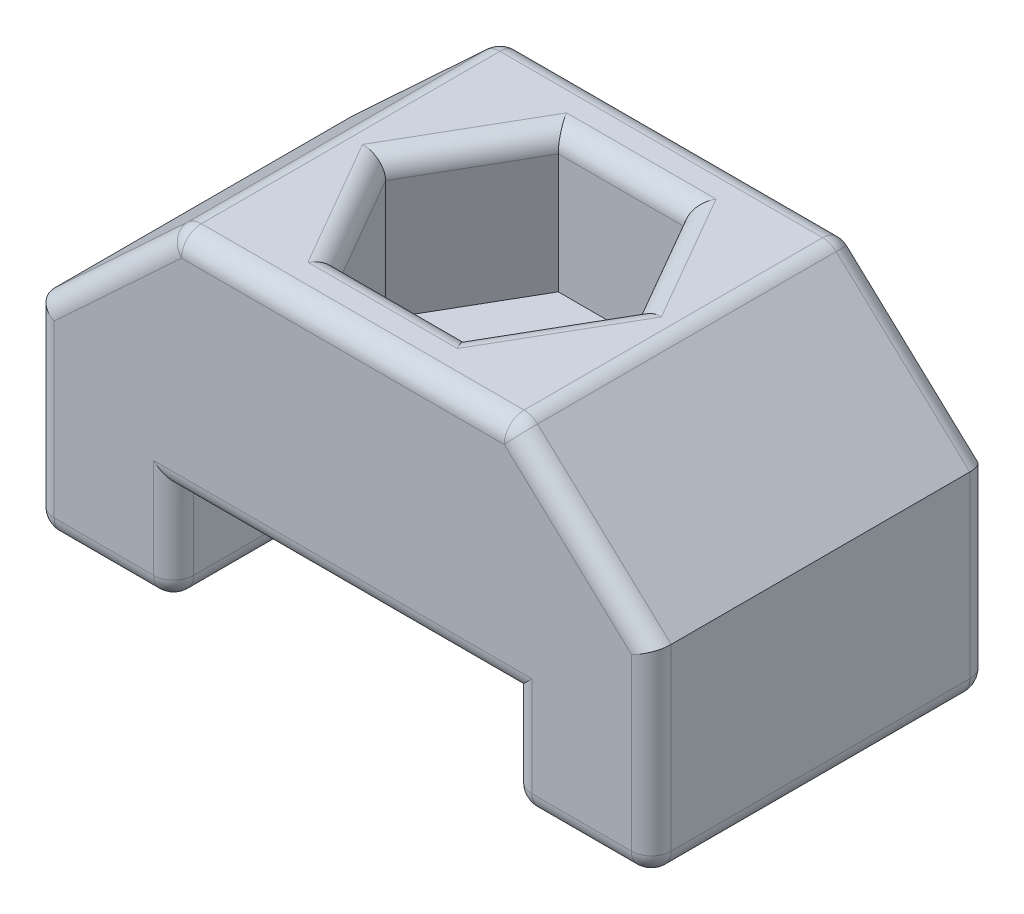
from build123d import *

# Parameters (mm, degrees)
BOSS_EXTRU_1_DEPTH      = 17
ENL_V_MAT_EXTRU_1_DEPTH = 7
ESQUISSE3_R             = 3
ENL_V_MAT_EXTRU_2_DEPTH = 5
CONG_1_R                = 1


with BuildPart() as part:
    # Esquisse1 → Boss.-Extru.1 (new body)
    with BuildSketch(Plane.XY):
        Polygon((-3, 1.840029022), (3, 1.840029022), (8.5, 1.840029022), (8.5, -3.159970978), (15.5, -3.159970978), (15.5, 6.840029022), (8.5, 13.340029022), (-8.5, 13.340029022), (-15.5, 6.840029022), (-15.5, -3.159970978), (-8.5, -3.159970978), (-8.5, 1.840029022), align=None)
    extrude(amount=BOSS_EXTRU_1_DEPTH)

    # Esquisse2 → Enlèv. mat.-Extru.1 (cut)
    with BuildSketch(Plane(origin=(0, 13.340029022, 0), x_dir=(1, 0, 0), z_dir=(0, 1, 0))):
        Polygon((6.350852961, -8.5), (3.175426481, -3), (-3.175426481, -3), (-6.350852961, -8.5), (-3.175426481, -14), (3.175426481, -14), align=None)
    extrude(amount=-ENL_V_MAT_EXTRU_1_DEPTH, mode=Mode.SUBTRACT)

    # Esquisse3 → Enlèv. mat.-Extru.2 (cut)
    with BuildSketch(Plane(origin=(0, 6.340029022, 0), x_dir=(1, 0, 0), z_dir=(0, 1, 0))):
        with Locations(Location((0, -8.5, 0), (0, 0, 270))):
            Circle(ESQUISSE3_R)
    extrude(amount=-ENL_V_MAT_EXTRU_2_DEPTH, mode=Mode.SUBTRACT)

    # Congé1
    cong_1_edges = [part.edges().sort_by_distance(p)[0] for p in [
        (12, -3.159970978, 17),
        (0, 1.840029022, 0),
        (-8.5, -0.659970978, 0),
        (-12, -3.159970978, 0),
        (-15.5, 1.840029022, 0),
        (-12, 10.090029022, 0),
        (15.5, 1.840029022, 17),
        (0, 13.340029022, 0),
        (12, 10.090029022, 0),
        (15.5, 1.840029022, 0),
        (12, -3.159970978, 0),
        (8.5, -0.659970978, 0),
        (12, 10.090029022, 17),
        (0, 13.340029022, 17),
        (-8.5, -3.159970978, 8.5),
        (-15.5, -3.159970978, 8.5),
        (-8.5, 13.340029022, 8.5),
        (8.5, 13.340029022, 8.5),
        (15.5, -3.159970978, 8.5),
        (8.5, -3.159970978, 8.5),
        (-12, 10.090029022, 17),
        (-15.5, 1.840029022, 17),
        (-12, -3.159970978, 17),
        (-8.5, -0.659970978, 17),
        (0, 1.840029022, 17),
        (4.763139721, 13.340029022, 11.25),
        (4.763139721, 13.340029022, 5.75),
        (0, 13.340029022, 3),
        (-4.763139721, 13.340029022, 5.75),
        (-4.763139721, 13.340029022, 11.25),
        (0, 13.340029022, 14),
        (8.5, -0.659970978, 17),
    ]]
    fillet(cong_1_edges, radius=CONG_1_R)


solid = part.part
